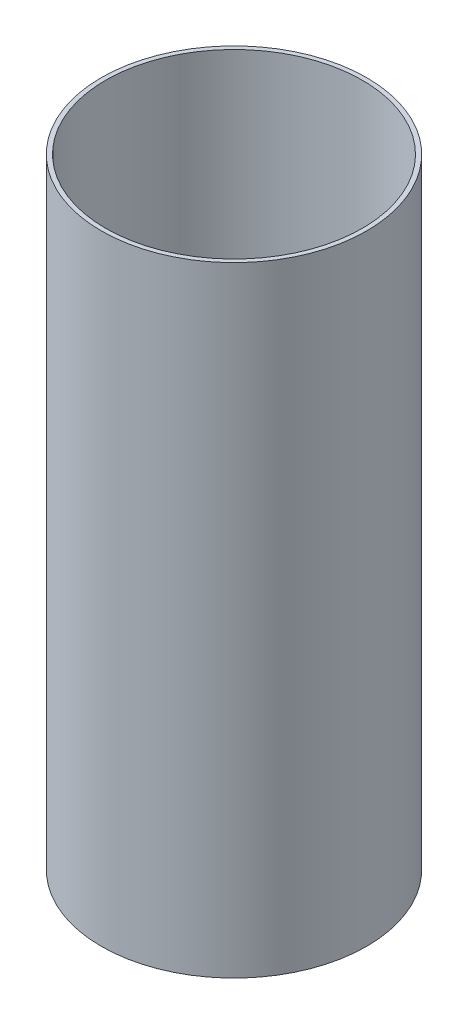
from build123d import *

# Parameters (mm, degrees)
SKETCH1_R           = 76.1746
SKETCH1_R_2         = 73.66
BOSS_EXTRUDE1_DEPTH = 355.6


with BuildPart() as part:
    # Sketch1 → Boss-Extrude1 (new body)
    with BuildSketch(Plane(origin=(0, 0, 0), x_dir=(1, 0, 0), z_dir=(0, 1, 0))):
        with Locations(Location((0, 0, 0), (0, 0, 270))):
            Circle(SKETCH1_R)
        with Locations(Location((0, 0, 0), (0, 0, 270))):
            Circle(SKETCH1_R_2, mode=Mode.SUBTRACT)
    extrude(amount=BOSS_EXTRUDE1_DEPTH)


solid = part.part
